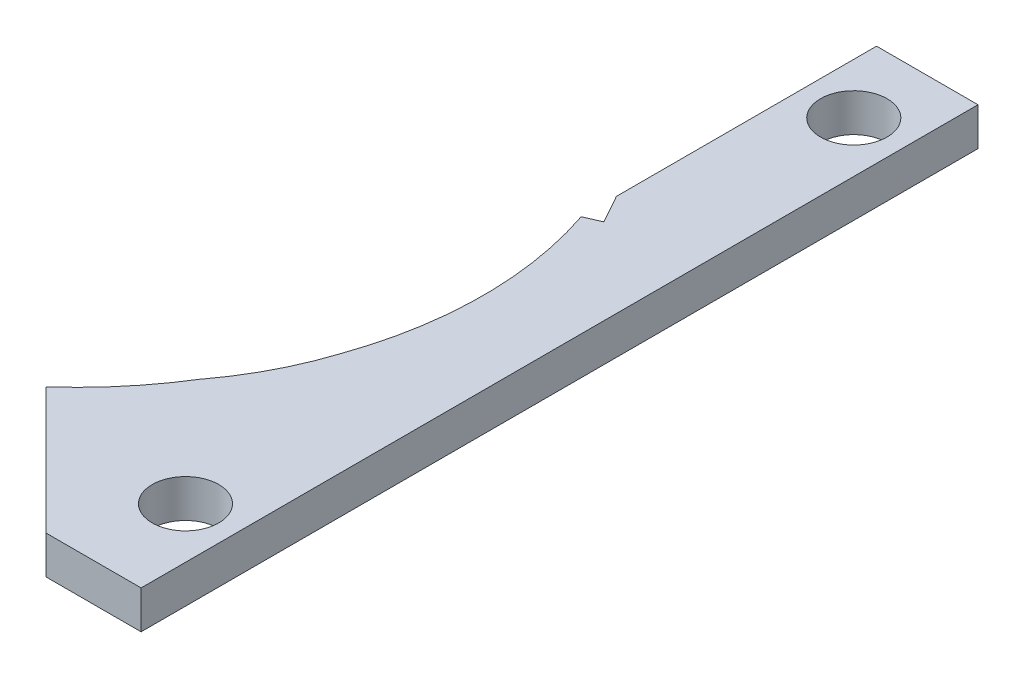
from build123d import *

# Parameters (mm, degrees)
MODEL_R             = 5.25
BOSS_EXTRUDE1_DEPTH = 6
BOSS_EXTRUDE2_DEPTH = 6
SKETCH3_R           = 60.25
CUT_EXTRUDE1_DEPTH  = 10


with BuildPart() as part:
    # Model → Boss-Extrude1 (new body)
    with BuildSketch(Plane.XZ):
        with BuildLine():
            Line((694.500002921, -169.799850935), (696.999999799, -170.90000032))
            Line((696.999999799, -170.90000032), (694.500002921, -175.370624794))
            Line((694.500002921, -175.370624794), (694.500002921, -216.399998612))
            Line((694.500002921, -216.399998612), (710.5, -216.399998612))
            Line((710.5, -216.399998612), (710.5, -84.4))
            Line((710.5, -84.4), (695.5, -84.4))
            Line((695.5, -84.4), (695.5, -89.4))
            ThreePointArc((695.5, -89.4), (692.807600963, -103.748366696), (685.918459021, -116.61943358))
            ThreePointArc((685.918459021, -116.61943358), (690.782850281, -124.007719547), (694.236343401, -132.151579634))
            ThreePointArc((694.236343401, -132.151579634), (697.533641796, -150.953546779), (694.500002921, -169.799850935))
        make_face()
        with Locations(Location((702.5, -204.808507537, 0), (0, 0, 270))):
            Circle(MODEL_R, mode=Mode.SUBTRACT)
        with Locations(Location((702.5, -99.4, 0), (0, 0, 270))):
            Circle(MODEL_R, mode=Mode.SUBTRACT)
    extrude(amount=BOSS_EXTRUDE1_DEPTH)

    # Sketch2 → Boss-Extrude2 (add)
    with BuildSketch(Plane(origin=(0, 0, 0), x_dir=(1, 0, 0), z_dir=(0, 1, 0))):
        with BuildLine():
            Line((695.5, 84.4), (675.529768986, 104.370231014))
            ThreePointArc((675.529768986, 104.370231014), (681.656132965, 110.674376833), (686.799952909, 117.802890457))
            Line((686.799952909, 117.802890457), (697.045493523, 96.913214697))
            Line((697.045493523, 96.913214697), (695.5, 84.4))
        make_face()
    extrude(amount=-BOSS_EXTRUDE2_DEPTH)

    # Sketch3 → Cut-Extrude1 (cut)
    with BuildSketch(Plane(origin=(0, 0, 0), x_dir=(1, 0, 0), z_dir=(0, 1, 0))):
        with Locations((635.5, 149.4)):
            Circle(SKETCH3_R)
    extrude(amount=-CUT_EXTRUDE1_DEPTH, mode=Mode.SUBTRACT)


solid = part.part
